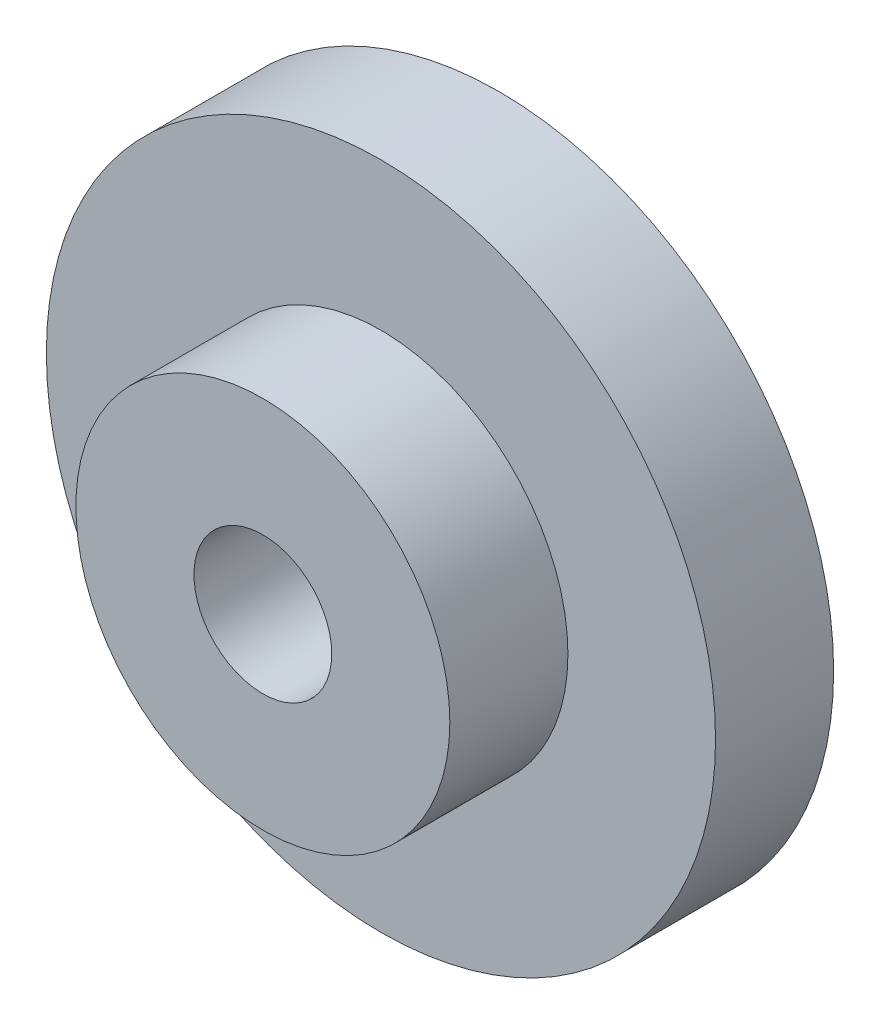
from build123d import *


with BuildPart() as part:
    # Sketch1 → Revolve1 (revolve)
    with BuildSketch(Plane(origin=(0, 0, 0), x_dir=(0, 0, -1), z_dir=(1, 0, 0)), mode=Mode.PRIVATE) as revolve1_sk:
        Polygon((-3.35483871, 0), (2.64516129, 0), (2.64516129, 6.75), (-0.35483871, 6.75), (-0.35483871, 3), (-3.35483871, 3), align=None)
    revolve(revolve1_sk.sketch.rotate(Axis((0, -1.75, 3.35483871), (0, 0, -1)), 90), axis=Axis((0, -1.75, 3.35483871), (0, 0, -1)))


solid = part.part
